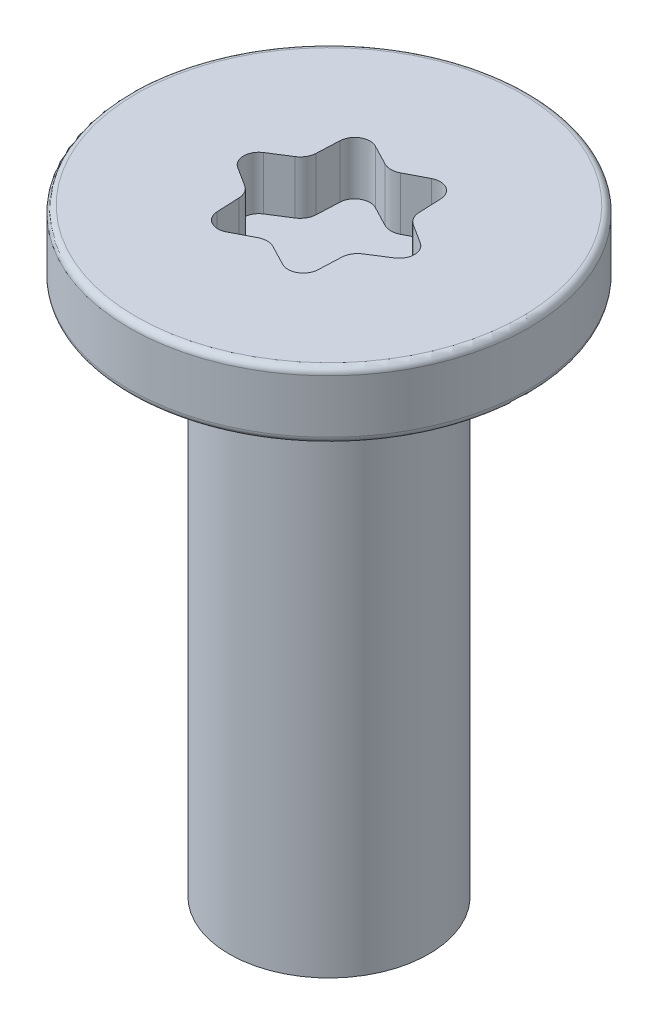
from build123d import *

# Parameters (mm, degrees)
FILLET1_R          = 0.1
SKETCH2_R          = 0.93
CUT_EXTRUDE1_DEPTH = 0.8


with BuildPart() as part:
    # Sketch1 → Revolve1 (revolve)
    with BuildSketch(Plane(origin=(0, 0, 0), x_dir=(0, 0, -1), z_dir=(1, 0, 0))):
        Polygon((0, 0), (0, -9), (1.5, -9), (1.5, -1), (3, -1), (3, 0), align=None)
    revolve(axis=Axis((0, 0, 0), (0, 1, 0)))

    # Fillet1
    fillet1_edges = [part.edges().sort_by_distance(p)[0] for p in [
        (0, 0, 3),
        (0, -1, 3),
    ]]
    fillet(fillet1_edges, radius=FILLET1_R)

    # Sketch2 → Cut-Extrude1 (cut)
    with BuildSketch(Plane(origin=(0, 0, 0), x_dir=(1, 0, 0), z_dir=(0, 1, 0))):
        Circle(SKETCH2_R)
        with BuildLine():
            ThreePointArc((0.757286248, 0.923570431), (0.724160575, 1.032923804), (0.6425, 1.112842644))
            ThreePointArc((0.6425, 1.112842644), (0.532457967, 1.143603357), (0.421192331, 1.117614344))
            Line((0.421192331, 1.117614344), (0.115551814, 0.958307018))
            ThreePointArc((0.115551814, 0.958307018), (0.059484261, 0.937179855), (0, 0.93))
            ThreePointArc((0, 0.93), (0.465000014, 0.805403617), (0.805403642, 0.464999972))
            ThreePointArc((0.805403642, 0.464999972), (0.781879437, 0.520104793), (0.772142315, 0.579224316))
            Line((0.772142315, 0.579224316), (0.757286248, 0.923570431))
        make_face()
        with BuildLine():
            ThreePointArc((-0.6425, 1.112842644), (-0.724160575, 1.032923804), (-0.757286248, 0.923570431))
            Line((-0.757286248, 0.923570431), (-0.772142315, 0.579224316))
            ThreePointArc((-0.772142315, 0.579224316), (-0.781879432, 0.52010481), (-0.805403624, 0.465000003))
            ThreePointArc((-0.805403624, 0.465000003), (-0.464999999, 0.805403626), (0, 0.93))
            ThreePointArc((0, 0.93), (-0.059484261, 0.937179855), (-0.115551814, 0.958307018))
            Line((-0.115551814, 0.958307018), (-0.421192331, 1.117614344))
            ThreePointArc((-0.421192331, 1.117614344), (-0.532457967, 1.143603357), (-0.6425, 1.112842644))
        make_face()
        with BuildLine():
            ThreePointArc((-0.805403626, -0.464999999), (-0.93, 2e-09), (-0.805403624, 0.465000003))
            ThreePointArc((-0.805403624, 0.465000003), (-0.841363692, 0.417075048), (-0.887694129, 0.379082702))
            Line((-0.887694129, 0.379082702), (-1.178478579, 0.194043914))
            ThreePointArc((-1.178478579, 0.194043914), (-1.256618542, 0.110679553), (-1.285, 0))
            ThreePointArc((-1.285, 0), (-1.256618542, -0.110679553), (-1.178478579, -0.194043914))
            Line((-1.178478579, -0.194043914), (-0.887694129, -0.379082702))
            ThreePointArc((-0.887694129, -0.379082702), (-0.841363693, -0.417075046), (-0.805403626, -0.464999999))
        make_face()
        with BuildLine():
            ThreePointArc((-3e-09, -0.93), (-0.465000002, -0.805403625), (-0.805403626, -0.464999999))
            ThreePointArc((-0.805403626, -0.464999999), (-0.781879432, -0.520104808), (-0.772142315, -0.579224316))
            Line((-0.772142315, -0.579224316), (-0.757286248, -0.923570431))
            ThreePointArc((-0.757286248, -0.923570431), (-0.724160575, -1.032923804), (-0.6425, -1.112842644))
            ThreePointArc((-0.6425, -1.112842644), (-0.532457967, -1.143603357), (-0.421192331, -1.117614344))
            Line((-0.421192331, -1.117614344), (-0.115551814, -0.958307018))
            ThreePointArc((-0.115551814, -0.958307018), (-0.059484262, -0.937179855), (-3e-09, -0.93))
        make_face()
        with BuildLine():
            ThreePointArc((0.805403624, -0.465000003), (0.464999998, -0.805403627), (-3e-09, -0.93))
            ThreePointArc((-3e-09, -0.93), (0.059484259, -0.937179855), (0.115551814, -0.958307018))
            Line((0.115551814, -0.958307018), (0.421192331, -1.117614344))
            ThreePointArc((0.421192331, -1.117614344), (0.532457967, -1.143603357), (0.6425, -1.112842644))
            ThreePointArc((0.6425, -1.112842644), (0.724160575, -1.032923804), (0.757286248, -0.923570431))
            Line((0.757286248, -0.923570431), (0.772142315, -0.579224316))
            ThreePointArc((0.772142315, -0.579224316), (0.781879432, -0.52010481), (0.805403624, -0.465000003))
        make_face()
        with BuildLine():
            ThreePointArc((1.178478579, -0.194043914), (1.256618542, -0.110679553), (1.285, 0))
            ThreePointArc((1.285, 0), (1.256618542, 0.110679553), (1.178478579, 0.194043914))
            Line((1.178478579, 0.194043914), (0.887694129, 0.379082702))
            ThreePointArc((0.887694129, 0.379082702), (0.841363704, 0.417075035), (0.805403642, 0.464999972))
            ThreePointArc((0.805403642, 0.464999972), (0.898311023, 0.240701696), (0.93, 0))
            ThreePointArc((0.93, 0), (0.898311018, -0.240701713), (0.805403624, -0.465000003))
            ThreePointArc((0.805403624, -0.465000003), (0.841363692, -0.417075048), (0.887694129, -0.379082702))
            Line((0.887694129, -0.379082702), (1.178478579, -0.194043914))
        make_face()
    extrude(amount=-CUT_EXTRUDE1_DEPTH, mode=Mode.SUBTRACT)


solid = part.part
